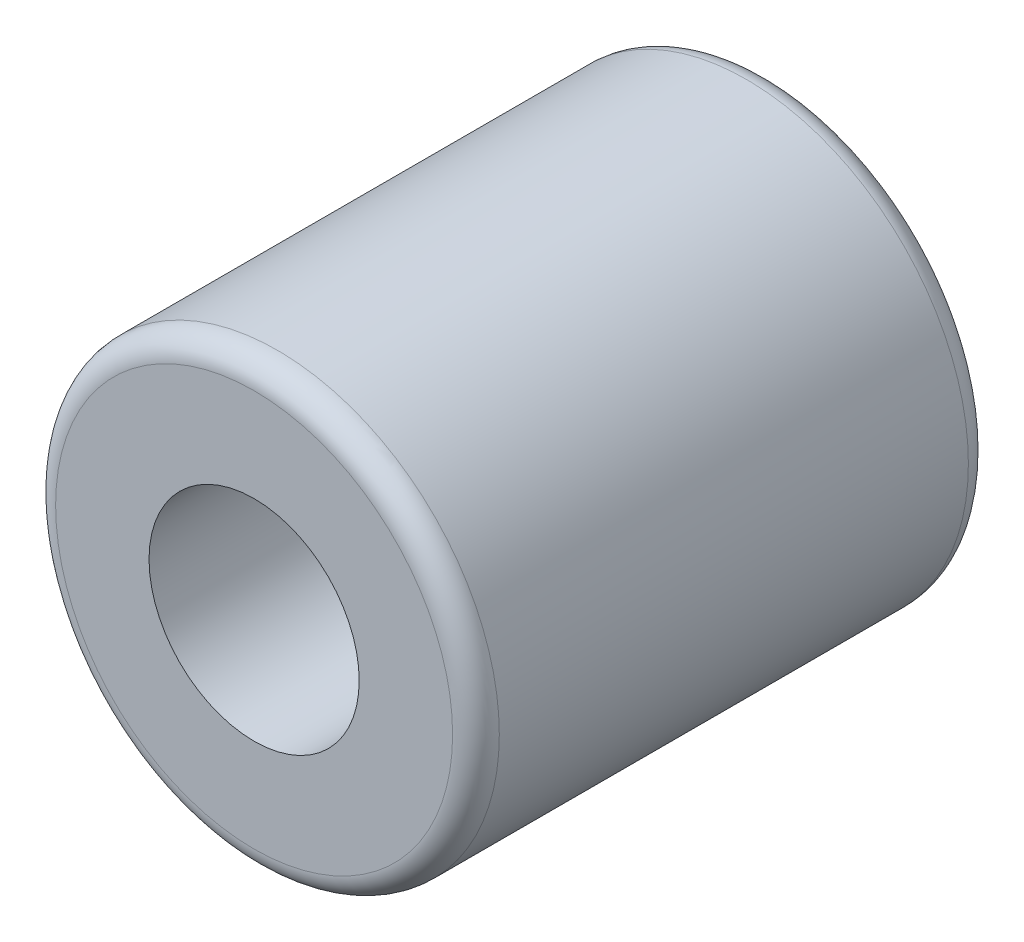
from build123d import *

# Parameters (mm, degrees)
SKETCH2_R           = 4.75
SKETCH2_R_2         = 2.25
BOSS_EXTRUDE1_DEPTH = 11.043203171
FILLET1_R           = 0.5


with BuildPart() as part:
    # Sketch2 → Boss-Extrude1 (new body)
    with BuildSketch(Plane.XY.offset(42.804996829)):
        with Locations((-51.25, 23.184046239)):
            Circle(SKETCH2_R)
        with Locations((-51.25, 23.184046239)):
            Circle(SKETCH2_R_2, mode=Mode.SUBTRACT)
    extrude(amount=BOSS_EXTRUDE1_DEPTH)

    # Fillet1
    fillet1_edges = [part.edges().sort_by_distance(p)[0] for p in [
        (-56, 23.184046239, 53.8482),
        (-56, 23.184046239, 42.804996829),
    ]]
    fillet(fillet1_edges, radius=FILLET1_R)


solid = part.part
